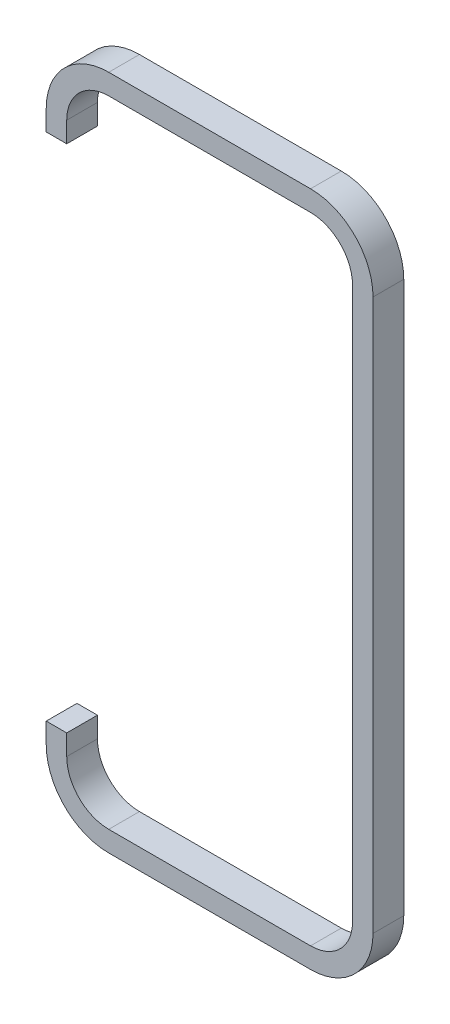
from build123d import *

# Parameters (mm, degrees)
BOSS_EXTRUDE1_DEPTH = 3


with BuildPart() as part:
    # Sketch1 → Boss-Extrude1 (new body)
    with BuildSketch(Plane(origin=(0, 0, 0), x_dir=(0, 1, 0), z_dir=(0, 0, 1))):
        with BuildLine():
            Line((-26.9, 13.95), (-24.9, 13.95))
            Line((-24.9, 13.95), (-24.9, 15.95))
            Line((-24.9, 15.95), (-26.9, 15.95))
            ThreePointArc((-26.9, 15.95), (-31.213351365, 14.163351365), (-33, 9.85))
            Line((-33, 9.85), (-33, -9.85))
            ThreePointArc((-33, -9.85), (-31.213351365, -14.163351365), (-26.9, -15.95))
            Line((-26.9, -15.95), (26.9, -15.95))
            ThreePointArc((26.9, -15.95), (31.213351365, -14.163351365), (33, -9.85))
            Line((33, -9.85), (33, 9.85))
            ThreePointArc((33, 9.85), (31.213351365, 14.163351365), (26.9, 15.95))
            Line((26.9, 15.95), (24.9, 15.95))
            Line((24.9, 15.95), (24.9, 13.95))
            Line((24.9, 13.95), (26.9, 13.95))
            ThreePointArc((26.9, 13.95), (29.799137803, 12.749137803), (31, 9.85))
            Line((31, 9.85), (31, -9.85))
            ThreePointArc((31, -9.85), (29.799137803, -12.749137803), (26.9, -13.95))
            Line((26.9, -13.95), (-26.9, -13.95))
            ThreePointArc((-26.9, -13.95), (-29.799137803, -12.749137803), (-31, -9.85))
            Line((-31, -9.85), (-31, 9.85))
            ThreePointArc((-31, 9.85), (-29.799137803, 12.749137803), (-26.9, 13.95))
        make_face()
    extrude(amount=BOSS_EXTRUDE1_DEPTH)


solid = part.part
